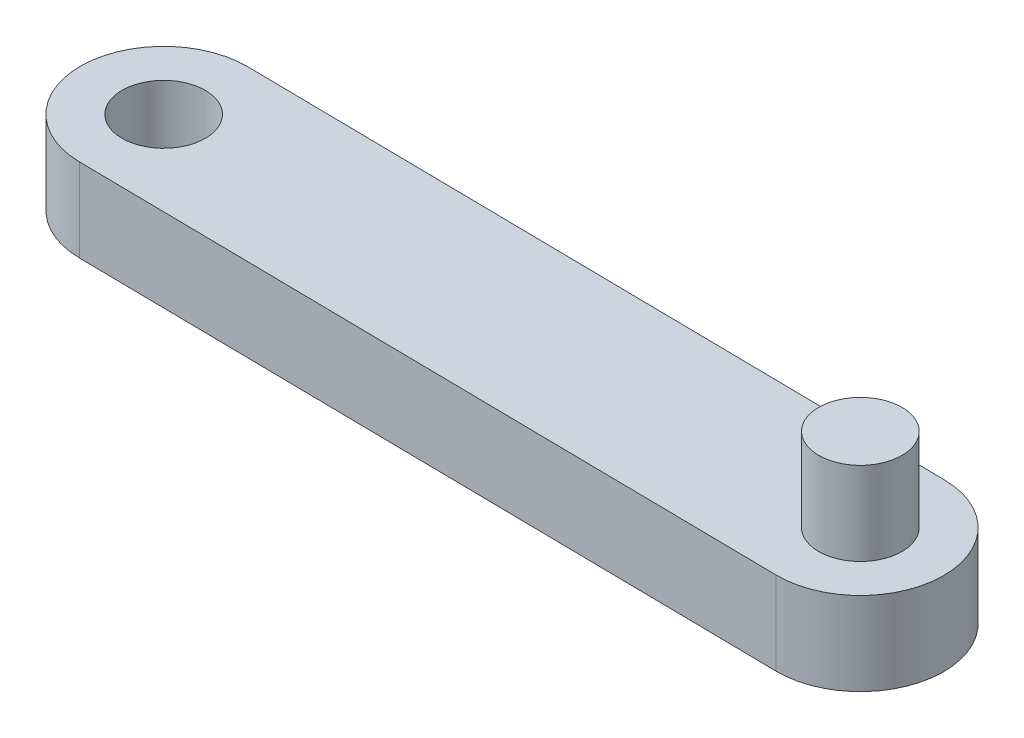
from build123d import *

# Parameters (mm, degrees)
SKETCH1_R           = 2.5
BOSS_EXTRUDE1_DEPTH = 5
SKETCH2_R           = 2.5
BOSS_EXTRUDE2_DEPTH = 5


with BuildPart() as part:
    # Sketch1 → Boss-Extrude1 (new body)
    with BuildSketch(Plane(origin=(0, 0, 0), x_dir=(1, 0, 0), z_dir=(0, 1, 0))):
        with BuildLine():
            Line((-14.504443595, 6.706697569), (27.895556405, 6.137023864))
            ThreePointArc((27.895556405, 6.137023864), (32.82793273, 1.070302658), (27.761211524, -3.862073668))
            Line((27.761211524, -3.862073668), (-14.638788476, -3.292399963))
            ThreePointArc((-14.638788476, -3.292399963), (-19.571164802, 1.774321243), (-14.504443595, 6.706697569))
        make_face()
        with Locations(Location((-14.571616036, 1.707148803, 0), (0, 0, 270))):
            Circle(SKETCH1_R, mode=Mode.SUBTRACT)
    extrude(amount=BOSS_EXTRUDE1_DEPTH)

    # Sketch2 → Boss-Extrude2 (add)
    with BuildSketch(Plane(origin=(0, 5, 0), x_dir=(1, 0, 0), z_dir=(0, 1, 0))):
        with Locations(Location((27.828383964, 1.137475098, 0), (0, 0, 270))):
            Circle(SKETCH2_R)
    extrude(amount=BOSS_EXTRUDE2_DEPTH)


solid = part.part
